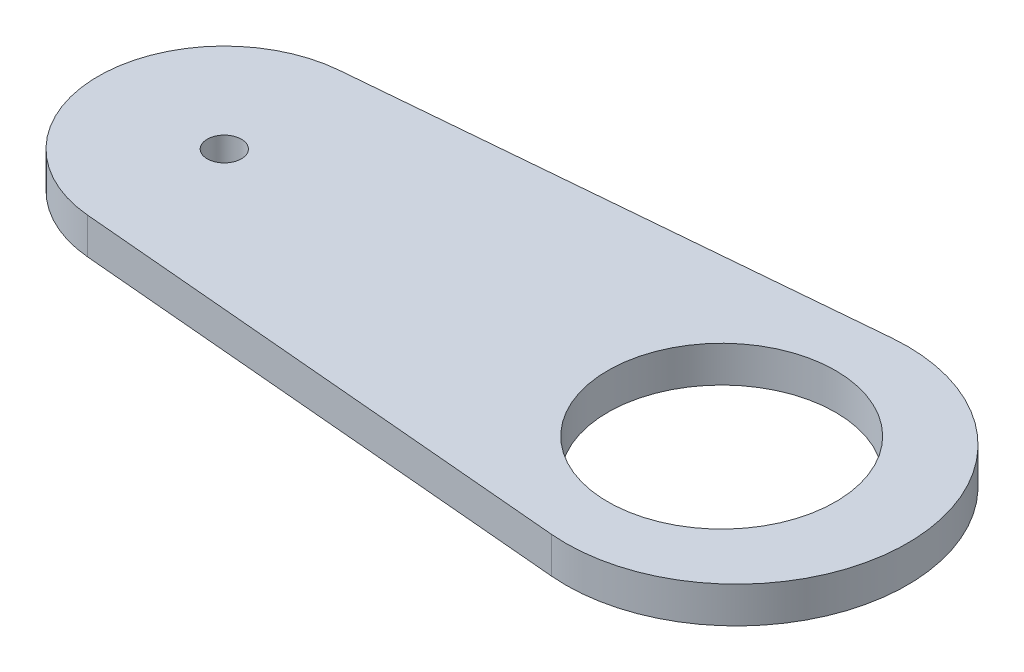
from build123d import *

# Parameters (mm, degrees)
SKETCH1_R           = 1.5
BOSS_EXTRUDE1_DEPTH = 3.18
SKETCH2_R           = 10
CUT_EXTRUDE1_DEPTH  = 3.18


with BuildPart() as part:
    # Sketch1 → Boss-Extrude1 (new body)
    with BuildSketch(Plane(origin=(0, 0, 0), x_dir=(1, 0, 0), z_dir=(0, 1, 0))):
        with BuildLine():
            Line((-36.950288588, 11.035836474), (7.707885855, 14.942920471))
            ThreePointArc((7.707885855, 14.942920471), (24.015221996, 0), (7.707885855, -14.942920471))
            Line((7.707885855, -14.942920471), (-36.950288588, -11.035836474))
            ThreePointArc((-36.950288588, -11.035836474), (-47.062769581, 0), (-36.950288588, 11.035836474))
        make_face()
        with Locations(Location((-35.984778004, 0, 0), (0, 0, 90))):
            Circle(SKETCH1_R, mode=Mode.SUBTRACT)
    extrude(amount=BOSS_EXTRUDE1_DEPTH)

    # Sketch2 → Cut-Extrude1 (cut)
    with BuildSketch(Plane.XZ):
        with Locations(Location((7.707885855, 0, 0), (0, 0, 270))):
            Circle(SKETCH2_R)
    extrude(amount=-CUT_EXTRUDE1_DEPTH, mode=Mode.SUBTRACT)


solid = part.part
